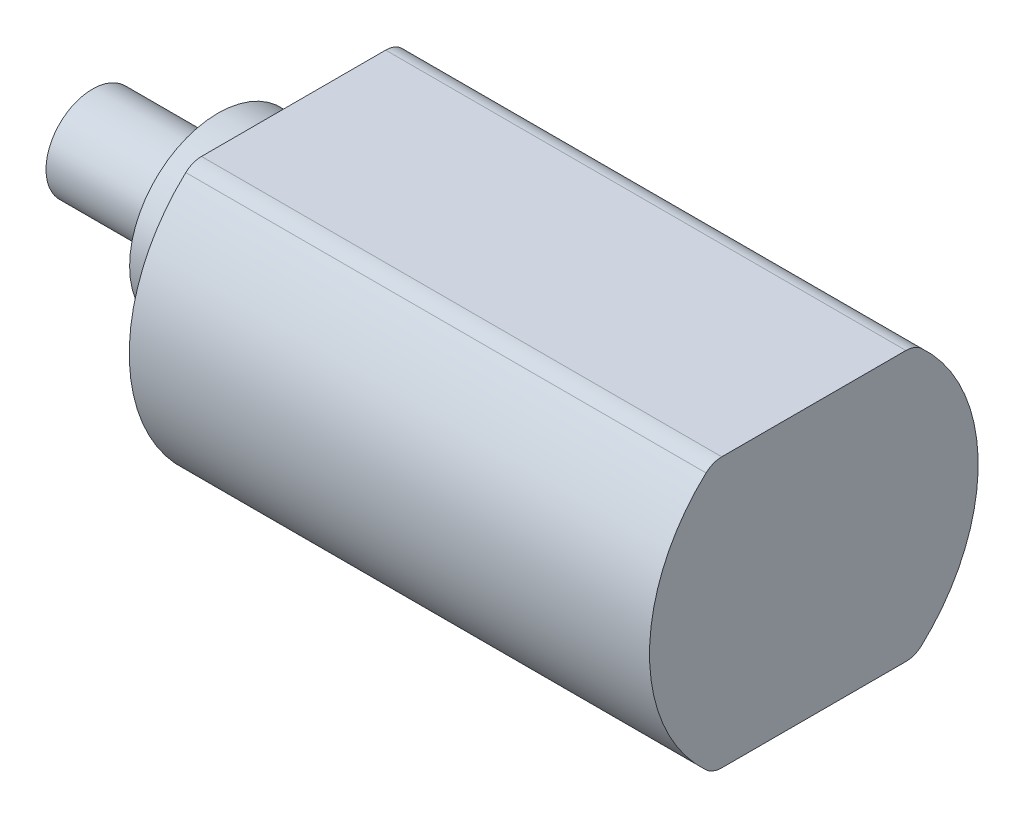
from build123d import *

# Parameters (mm, degrees)
BOSS_EXTRUDE1_DEPTH = 56.896
FILLET1_R           = 2.54
FILLET2_R           = 2.54
SKETCH2_R           = 9.652
BOSS_EXTRUDE2_DEPTH = 8.2804
SKETCH3_R           = 5.08
BOSS_EXTRUDE3_DEPTH = 13.716


with BuildPart() as part:
    # Sketch1 → Boss-Extrude1 (new body)
    with BuildSketch(Plane(origin=(0, 0, 0), x_dir=(0, 0, -1), z_dir=(1, 0, 0))):
        with BuildLine():
            Line((-11.019402446, 14.732), (11.019402446, 14.732))
            ThreePointArc((11.019402446, 14.732), (17.9705, 0), (11.019402446, -14.732))
            Line((11.019402446, -14.732), (-11.019402446, -14.732))
            ThreePointArc((-11.019402446, -14.732), (-17.9705, 0), (-11.019402446, 14.732))
        make_face()
    extrude(amount=BOSS_EXTRUDE1_DEPTH)

    # Fillet1
    fillet1_edges = [part.edges().sort_by_distance(p)[0] for p in [
        (28.448, -14.732, -11.019402446),
        (28.448, -14.732, 11.019402446),
    ]]
    fillet(fillet1_edges, radius=FILLET1_R)

    # Fillet2
    fillet2_edges = [part.edges().sort_by_distance(p)[0] for p in [
        (28.448, 14.732, 11.019402446),
        (28.448, 14.732, -11.019402446),
    ]]
    fillet(fillet2_edges, radius=FILLET2_R)

    # Sketch2 → Boss-Extrude2 (add)
    with BuildSketch(Plane.ZY):
        with Locations(Location((0, 0, 0), (0, 0, 180))):
            Circle(SKETCH2_R)
    extrude(amount=BOSS_EXTRUDE2_DEPTH)

    # Sketch3 → Boss-Extrude3 (add)
    with BuildSketch(Plane.ZY.offset(8.2804)):
        Circle(SKETCH3_R)
    extrude(amount=BOSS_EXTRUDE3_DEPTH)


solid = part.part
